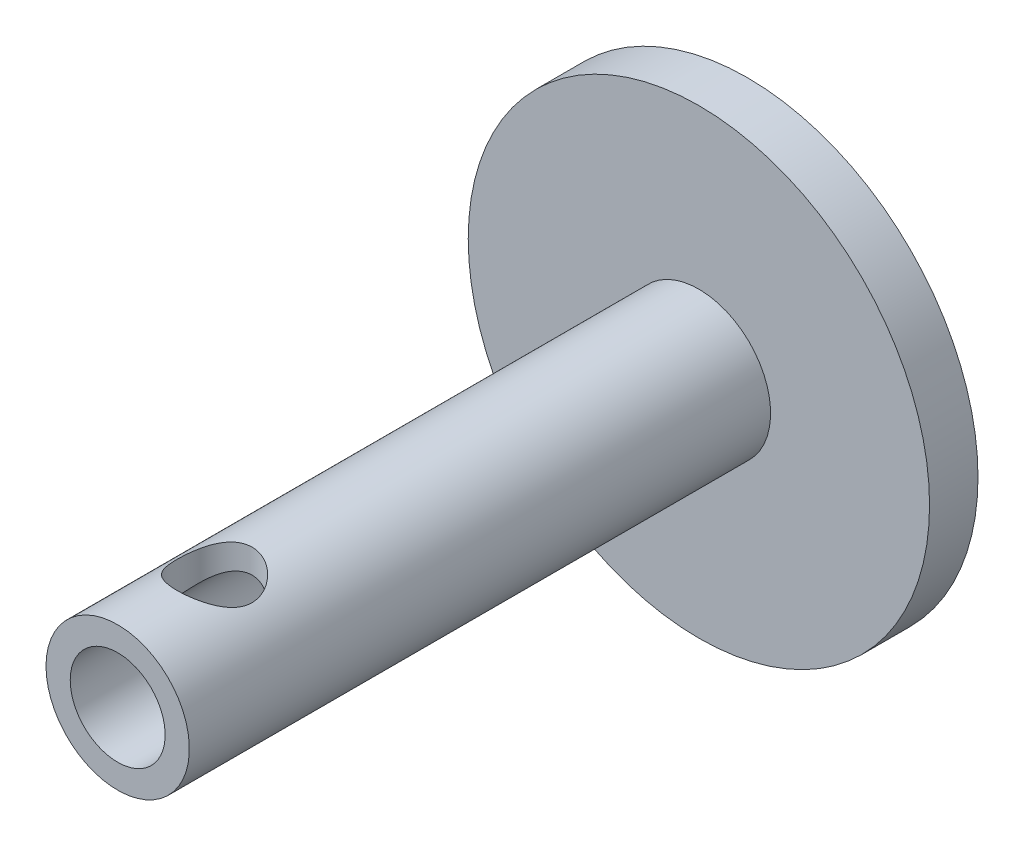
from build123d import *

# Parameters (mm, degrees)
M2_5_CLEARANCE_HOLE1_D = 3.1


with BuildPart() as part:
    # Sketch1 → Revolve1 (revolve)
    with BuildSketch(Plane(origin=(0, 0, 0), x_dir=(1, 0, 0), z_dir=(0, 1, 0)), mode=Mode.PRIVATE) as revolve1_sk:
        Polygon((1.96, -24), (1.96, 0), (0, 0), (0, 2), (9.525, 2), (9.525, 0), (2.96, 0), (2.96, -24), align=None)
    revolve(revolve1_sk.sketch.rotate(Axis((0, 0, -2), (0, 0, 1)), 180), axis=Axis((0, 0, -2), (0, 0, 1)))

    # M2.5 Clearance Hole1 (through all)
    with Locations(Plane(origin=(0, 2.96, 0), x_dir=(1, 0, 0), z_dir=(0, 1, 0))):
        with Locations((0, -20)):
            Hole(M2_5_CLEARANCE_HOLE1_D / 2)


solid = part.part
